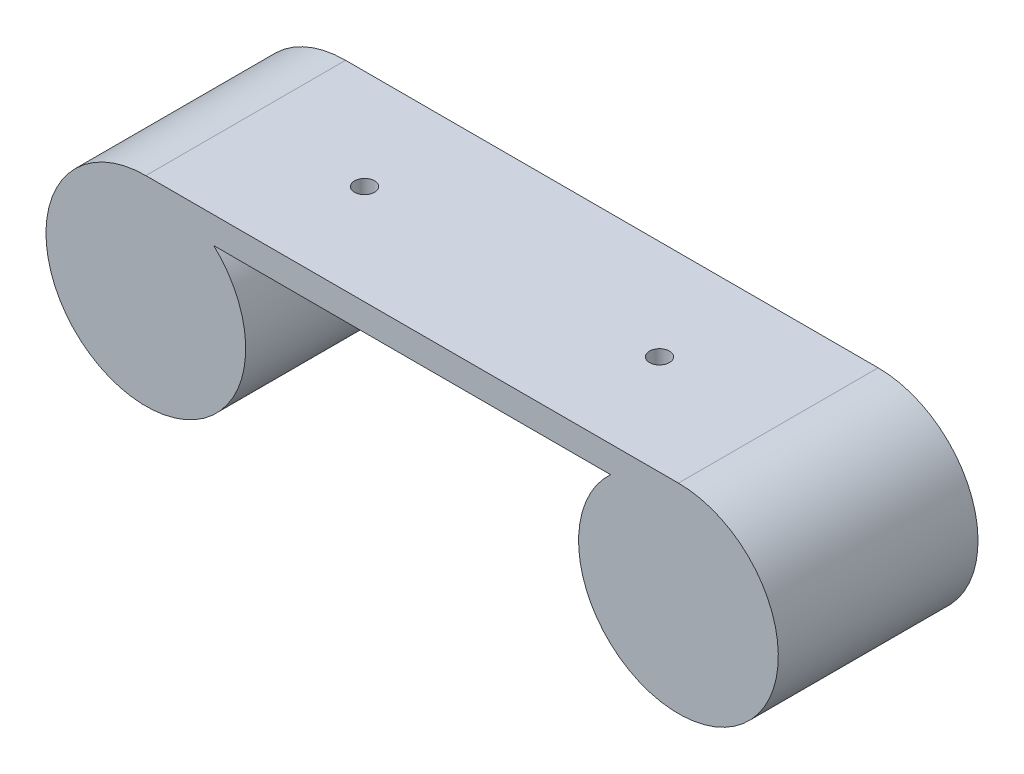
from build123d import *

# Parameters (mm, degrees)
SKETCH1_R           = 9.45
BOSS_EXTRUDE1_DEPTH = 30
SKETCH3_R           = 1.5
CUT_EXTRUDE1_DEPTH  = 6
BOSS_EXTRUDE2_START = -2
SKETCH5_R           = 9.45
BOSS_EXTRUDE2_DEPTH = 2


with BuildPart() as part:
    # Sketch1 → Boss-Extrude1 (new body)
    with BuildSketch(Plane.XY):
        with BuildLine():
            Line((-40, 15), (40, 15))
            ThreePointArc((40, 15), (45.476992863, -13.964331319), (29.802327604, 11.00033989))
            Line((29.802327604, 11.00033989), (-29.802327604, 11.00033989))
            ThreePointArc((-29.802327604, 11.00033989), (-45.476992863, -13.964331319), (-40, 15))
        make_face()
        with Locations((-40, 0)):
            Circle(SKETCH1_R, mode=Mode.SUBTRACT)
        with Locations((40, 0)):
            Circle(SKETCH1_R, mode=Mode.SUBTRACT)
    extrude(amount=BOSS_EXTRUDE1_DEPTH)

    # Sketch3 → Cut-Extrude1 (cut)
    with BuildSketch(Plane(origin=(0, 15, 0), x_dir=(1, 0, 0), z_dir=(0, 1, 0))):
        with Locations(Location((-22.15, -15, 0), (0, 0, 270))):
            Circle(SKETCH3_R)
        with Locations(Location((22.15, -15, 0), (0, 0, 270))):
            Circle(SKETCH3_R)
    extrude(amount=-CUT_EXTRUDE1_DEPTH, mode=Mode.SUBTRACT)

    # Sketch5 → Boss-Extrude2 (add)
    with BuildSketch(Plane.XY.offset(30).offset(BOSS_EXTRUDE2_START)):
        with Locations((-40, 0)):
            Circle(SKETCH5_R)
        with Locations((40, 0)):
            Circle(SKETCH5_R)
    extrude(amount=BOSS_EXTRUDE2_DEPTH)


solid = part.part
